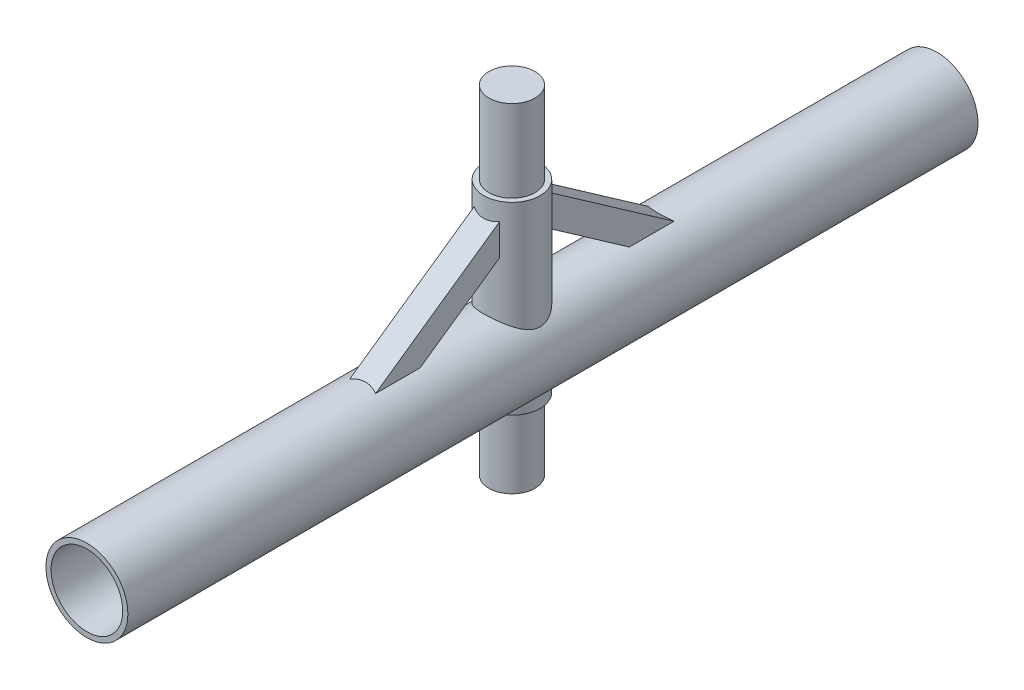
from build123d import *

# Parameters (mm, degrees)
SKETCH1_R                = 40
SKETCH1_R_2              = 35
EXTRUDE_THIN1_DEPTH      = 415
EXTRUDE_THIN2_DEPTH      = 140
EXTRUDE_THIN2_DEPTH_BACK = 40
SKETCH2_R                = 27.5
SKETCH2_R_2              = 22.5
BOSS_EXTRUDE1_DEPTH      = 80
BOSS_EXTRUDE1_DEPTH_BACK = 250
SKETCH3_R                = 22.5
EXTRUDE_THIN3_DEPTH      = 12.5
SKETCH5_R                = 35
CUT_EXTRUDE1_DEPTH       = 860.592927015


with BuildPart() as part:
    # Sketch1 → Extrude-Thin1 (new, symmetric)
    with BuildSketch(Plane.XY):
        Circle(SKETCH1_R)
        Circle(SKETCH1_R_2, mode=Mode.SUBTRACT)
    extrude(amount=EXTRUDE_THIN1_DEPTH, both=True)

    # Sketch2 → Extrude-Thin2 (add, two sides: drawn at the far end of the back side and taken through both)
    with BuildSketch(Plane(origin=(0, 0, 0), x_dir=(1, 0, 0), z_dir=(0, 1, 0)).offset(-EXTRUDE_THIN2_DEPTH_BACK)):
        Circle(SKETCH2_R)
        Circle(SKETCH2_R_2, mode=Mode.SUBTRACT)
    extrude(amount=EXTRUDE_THIN2_DEPTH + EXTRUDE_THIN2_DEPTH_BACK)

    # Sketch3 → Boss-Extrude1 (add, two sides: drawn at the far end of the back side and taken through both)
    with BuildSketch(Plane(origin=(0, 140, 0), x_dir=(1, 0, 0), z_dir=(0, 1, 0)).offset(-BOSS_EXTRUDE1_DEPTH_BACK)):
        with Locations(Location((0, 0, 0), (0, 0, 270))):
            Circle(SKETCH3_R)
    extrude(amount=BOSS_EXTRUDE1_DEPTH + BOSS_EXTRUDE1_DEPTH_BACK)


with BuildPart() as body_2:
    # Sketch4 → Extrude-Thin3 (new, symmetric)
    with BuildSketch(Plane(origin=(0, 0, 0), x_dir=(0, 0, -1), z_dir=(1, 0, 0))):
        Polygon((0, 140), (-200, 0), (-185.663441391, -20.480798013), (14.336558609, 119.519201987), align=None)
    extrude(amount=EXTRUDE_THIN3_DEPTH, both=True)


with BuildPart() as body_3:
    # Mirror1: mirrored copy
    add(body_2.part.mirror(Plane.XY))


with BuildPart() as cut_extrude1_tool:
    # Sketch5 → Cut-Extrude1 (new, through all)
    with BuildSketch(Plane.XY.offset(415)):
        Circle(SKETCH5_R)
    extrude(amount=-CUT_EXTRUDE1_DEPTH)


with BuildPart() as part_1:
    add(part.part)

    # Cut-Extrude1: cut by cut_extrude1_tool
    add(cut_extrude1_tool.part, mode=Mode.SUBTRACT)


with BuildPart() as body_2_1:
    add(body_2.part)

    # Cut-Extrude1: cut by cut_extrude1_tool
    add(cut_extrude1_tool.part, mode=Mode.SUBTRACT)


with BuildPart() as body_3_1:
    add(body_3.part)

    # Cut-Extrude1: cut by cut_extrude1_tool
    add(cut_extrude1_tool.part, mode=Mode.SUBTRACT)


solid = Compound([part_1.part, body_2_1.part, body_3_1.part])
